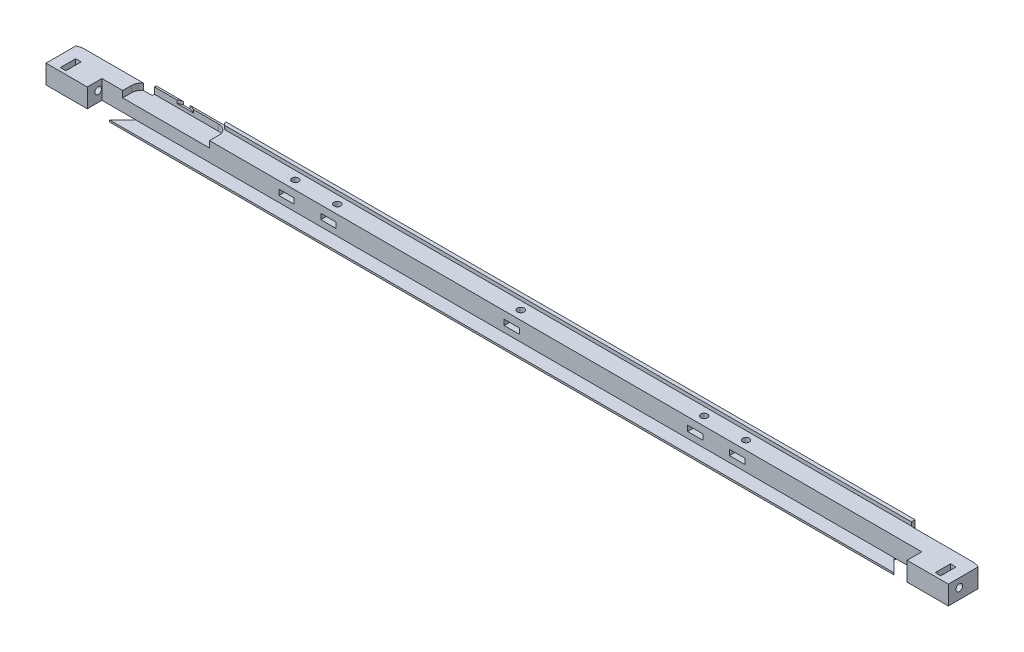
from build123d import *

# Parameters (mm, degrees)
BOSS_EXTRUDE1_DEPTH = 8
SKETCH2_W           = 22.44
SKETCH2_H           = 10.3
CUT_EXTRUDE1_DEPTH  = 0.6
SKETCH3_W           = 24.44
SKETCH3_H           = 10.3
CUT_EXTRUDE2_DEPTH  = 0.6
BOSS_EXTRUDE2_DEPTH = 0.6
SKETCH5_R           = 1.1
CUT_EXTRUDE3_DEPTH  = 296.386661852
CUT_EXTRUDE4_START  = -3.6
CUT_EXTRUDE4_DEPTH  = 1.8
CUT_EXTRUDE5_START  = -3.6
CUT_EXTRUDE5_DEPTH  = 1.8
SKETCH8_W           = 295.2
SKETCH8_H           = 10.4
CUT_EXTRUDE6_DEPTH  = 1.2
CUT_EXTRUDE7_START  = -2.4
CUT_EXTRUDE7_DEPTH  = 1.8
SKETCH10_R          = 1.1
CUT_EXTRUDE8_DEPTH  = 5
SKETCH11_W          = 5
SKETCH11_H          = 2.2
CUT_EXTRUDE9_DEPTH  = 0.2
SKETCH12_W          = 2.2
SKETCH12_H          = 2.2
CUT_EXTRUDE10_DEPTH = 0.2
CUT_EXTRUDE11_DEPTH = 1.2
CUT_EXTRUDE12_DEPTH = 2.1
CUT_EXTRUDE13_START = 1.1
SKETCH15_R          = 5.6
CUT_EXTRUDE13_DEPTH = 1


with BuildPart() as part:
    # Sketch1 → Boss-Extrude1 (new body)
    with BuildSketch(Plane(origin=(0, 0, 0), x_dir=(1, 0, 0), z_dir=(0, 1, 0))):
        with BuildLine():
            Line((-134.1, 0), (134.1, 0))
            Line((134.1, 0), (134.1, -4.8))
            Line((134.1, -4.8), (147.6, -4.8))
            Line((147.6, -4.8), (147.6, 4.898780306))
            ThreePointArc((147.6, 4.898780306), (146.488640518, 5.347211642), (145.3, 5.5))
            Line((145.3, 5.5), (125.16, 5.5))
            Line((125.16, 5.5), (125.16, 6.8))
            Line((125.16, 6.8), (-123.16, 6.8))
            Line((-123.16, 6.8), (-123.16, 5.5))
            Line((-123.16, 5.5), (-145.3, 5.5))
            ThreePointArc((-145.3, 5.5), (-146.488640518, 5.347211642), (-147.6, 4.898780306))
            Line((-147.6, 4.898780306), (-147.6, -4.8))
            Line((-147.6, -4.8), (-134.1, -4.8))
            Line((-134.1, -4.8), (-134.1, 0))
        make_face()
    extrude(amount=BOSS_EXTRUDE1_DEPTH)

    # Sketch2 → Cut-Extrude1 (cut)
    with BuildSketch(Plane.XZ):
        with Locations((136.38, -0.35)):
            Rectangle(SKETCH2_W, SKETCH2_H)
    extrude(amount=-CUT_EXTRUDE1_DEPTH, mode=Mode.SUBTRACT)

    # Sketch3 → Cut-Extrude2 (cut)
    with BuildSketch(Plane.XZ):
        with Locations((-135.38, -0.35)):
            Rectangle(SKETCH3_W, SKETCH3_H)
    extrude(amount=-CUT_EXTRUDE2_DEPTH, mode=Mode.SUBTRACT)

    # Sketch4 → Boss-Extrude2 (add)
    with BuildSketch(Plane.XZ):
        Polygon((129.318578644, 4.3), (125.16, 0.141421356), (125.16, 0), (-123.16, 0), (-123.16, 0.141421356), (-127.318578644, 4.3), align=None)
    extrude(amount=-BOSS_EXTRUDE2_DEPTH)

    # Sketch5 → Cut-Extrude3 (cut, through all)
    with BuildSketch(Plane(origin=(147.6, 0, 0), x_dir=(0, 0, -1), z_dir=(1, 0, 0))):
        with Locations((-1.2, 4)):
            Circle(SKETCH5_R)
    extrude(amount=-CUT_EXTRUDE3_DEPTH, mode=Mode.SUBTRACT)

    # Sketch6 → Cut-Extrude4 (cut)
    with BuildSketch(Plane(origin=(147.6, 0, 0), x_dir=(0, 0, -1), z_dir=(1, 0, 0)).offset(CUT_EXTRUDE4_START)):
        Polygon((-3.7, 5.443375673), (-3.7, 8), (1.3, 8), (1.3, 5.443375673), (1.3, 2.556624327), (-1.2, 1.113248654), (-3.7, 2.556624327), align=None)
    extrude(amount=-CUT_EXTRUDE4_DEPTH, mode=Mode.SUBTRACT)

    # Sketch7 → Cut-Extrude5 (cut)
    with BuildSketch(Plane.ZY.offset(147.6).offset(CUT_EXTRUDE5_START)):
        Polygon((-1.3, 8), (-1.3, 2.556624327), (1.2, 1.113248654), (3.7, 2.556624327), (3.7, 8), align=None)
    extrude(amount=-CUT_EXTRUDE5_DEPTH, mode=Mode.SUBTRACT)

    # Sketch8 → Cut-Extrude6 (cut)
    with BuildSketch(Plane(origin=(0, 8, 0), x_dir=(1, 0, 0), z_dir=(0, 1, 0))):
        with Locations((0, 0.4)):
            Rectangle(SKETCH8_W, SKETCH8_H)
    extrude(amount=-CUT_EXTRUDE6_DEPTH, mode=Mode.SUBTRACT)

    # Sketch9 → Cut-Extrude7 (cut)
    with BuildSketch(Plane(origin=(0, 6.8, 0), x_dir=(1, 0, 0), z_dir=(0, 1, 0)).offset(CUT_EXTRUDE7_START)):
        Polygon((-71.2, 1.456624327), (-71.2, 4.343375673), (-73.7, 5.786751346), (-76.2, 4.343375673), (-76.2, 1.456624327), (-76.2, 0), (-71.2, 0), align=None)
        Polygon((76.2, 1.456624327), (76.2, 4.343375673), (73.7, 5.786751346), (71.2, 4.343375673), (71.2, 1.456624327), (71.2, 0), (76.2, 0), align=None)
        Polygon((-57.5, 1.456624327), (-57.5, 4.343375673), (-60, 5.786751346), (-62.5, 4.343375673), (-62.5, 1.456624327), (-62.5, 0), (-57.5, 0), align=None)
        Polygon((2.5, 1.456624327), (2.5, 4.343375673), (0, 5.786751346), (-2.5, 4.343375673), (-2.5, 1.456624327), (-2.5, 0), (2.5, 0), align=None)
        Polygon((62.5, 1.456624327), (62.5, 4.343375673), (60, 5.786751346), (57.5, 4.343375673), (57.5, 1.456624327), (57.5, 0), (62.5, 0), align=None)
    extrude(amount=-CUT_EXTRUDE7_DEPTH, mode=Mode.SUBTRACT)

    # Sketch10 → Cut-Extrude8 (cut)
    with BuildSketch(Plane(origin=(0, 6.8, 0), x_dir=(1, 0, 0), z_dir=(0, 1, 0))):
        with Locations(Location((-73.7, 2.9, 0), (0, 0, 270))):
            Circle(SKETCH10_R)
        with Locations(Location((73.7, 2.9, 0), (0, 0, 270))):
            Circle(SKETCH10_R)
        with Locations(Location((60, 2.9, 0), (0, 0, 270))):
            Circle(SKETCH10_R)
        with Locations(Location((0, 2.9, 0), (0, 0, 270))):
            Circle(SKETCH10_R)
        with Locations(Location((-60, 2.9, 0), (0, 0, 270))):
            Circle(SKETCH10_R)
    extrude(amount=-CUT_EXTRUDE8_DEPTH, mode=Mode.SUBTRACT)

    # Sketch11 → Cut-Extrude9 (cut)
    with BuildSketch(Plane.XZ.offset(-4.4)):
        with Locations((73.7, -2.9)):
            Rectangle(SKETCH11_W, SKETCH11_H)
        with Locations((60, -2.9)):
            Rectangle(SKETCH11_W, SKETCH11_H)
        with Locations((0, -2.9)):
            Rectangle(SKETCH11_W, SKETCH11_H)
        with Locations((-60, -2.9)):
            Rectangle(SKETCH11_W, SKETCH11_H)
        with Locations((-73.7, -2.9)):
            Rectangle(SKETCH11_W, SKETCH11_H)
    extrude(amount=-CUT_EXTRUDE9_DEPTH, mode=Mode.SUBTRACT)

    # Sketch12 → Cut-Extrude10 (cut)
    with BuildSketch(Plane(origin=(0, 4.6, 0), x_dir=(-1, 0, 0), z_dir=(0, -1, 0))):
        with Locations((73.7, 2.9)):
            Rectangle(SKETCH12_W, SKETCH12_H)
        with Locations((60, 2.9)):
            Rectangle(SKETCH12_W, SKETCH12_H)
        with Locations((0, 2.9)):
            Rectangle(SKETCH12_W, SKETCH12_H)
        with Locations((-60, 2.9)):
            Rectangle(SKETCH12_W, SKETCH12_H)
        with Locations((-73.7, 2.9)):
            Rectangle(SKETCH12_W, SKETCH12_H)
    extrude(amount=-CUT_EXTRUDE10_DEPTH, mode=Mode.SUBTRACT)

    # Sketch13 → Cut-Extrude11 (cut)
    with BuildSketch(Plane(origin=(0, 8, 0), x_dir=(1, 0, 0), z_dir=(0, 1, 0))):
        with BuildLine():
            Line((-100.3, 6.8), (-123.16, 6.8))
            Line((-123.16, 6.8), (-123.16, 5.5))
            Line((-123.16, 5.5), (-99.1, 5.6))
            ThreePointArc((-99.1, 5.6), (-99.948528137, 5.951471863), (-100.3, 6.8))
        make_face()
    extrude(amount=-CUT_EXTRUDE11_DEPTH, mode=Mode.SUBTRACT)

    # Sketch14 → Cut-Extrude12 (cut)
    with BuildSketch(Plane(origin=(0, 6.8, 0), x_dir=(1, 0, 0), z_dir=(0, 1, 0))):
        with BuildLine():
            Line((-98.9, 0), (-127.3, 0))
            Line((-127.3, 0), (-127.3, 2.9))
            add(Edge.make_bspline(
                [(-123.9, 6.2), (-127.3, 6.2), (-127.3, 2.9)],
                knots=[4.71238898, 4.71238898, 4.71238898, 6.283185307, 6.283185307, 6.283185307], degree=2, weights=[1, 0.707106781, 1]))
            Line((-123.9, 6.2), (-102.1, 6.2))
            add(Edge.make_bspline(
                [(-98.9, 3.1), (-98.9, 6.2), (-102.1, 6.2)],
                knots=[3.141592654, 3.141592654, 3.141592654, 4.71238898, 4.71238898, 4.71238898], degree=2, weights=[1, 0.707106781, 1]))
            Line((-98.9, 3.1), (-98.9, 0))
        make_face()
    extrude(amount=-CUT_EXTRUDE12_DEPTH, mode=Mode.SUBTRACT)

    # Sketch15 → Cut-Extrude13 (cut)
    with BuildSketch(Plane(origin=(0, 4.7, 0), x_dir=(1, 0, 0), z_dir=(0, 1, 0)).offset(CUT_EXTRUDE13_START)):
        with Locations((-113.1, 1.3)):
            Circle(SKETCH15_R)
    extrude(amount=CUT_EXTRUDE13_DEPTH, mode=Mode.SUBTRACT)


solid = part.part
